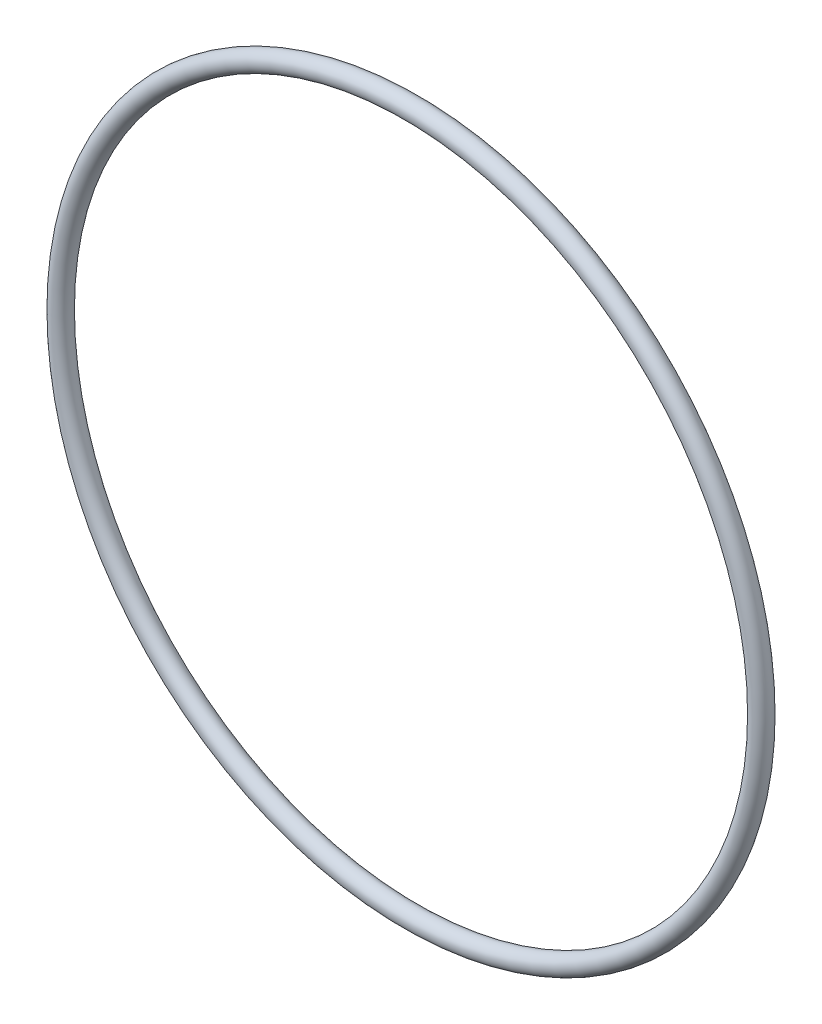
from build123d import *

# Parameters (mm, degrees)
SKETCH1_R = 3


with BuildPart() as part:
    # Sketch1 → Revolve1 (revolve)
    with BuildSketch(Plane(origin=(0, 0, 0), x_dir=(0, -1, 0), z_dir=(1, 0, 0)), mode=Mode.PRIVATE) as revolve1_sk:
        with Locations((108, 0)):
            Circle(SKETCH1_R)
    revolve(revolve1_sk.sketch.rotate(Axis((0, 0, 3), (0, 0, -1)), 270), axis=Axis((0, 0, 3), (0, 0, -1)))


solid = part.part
